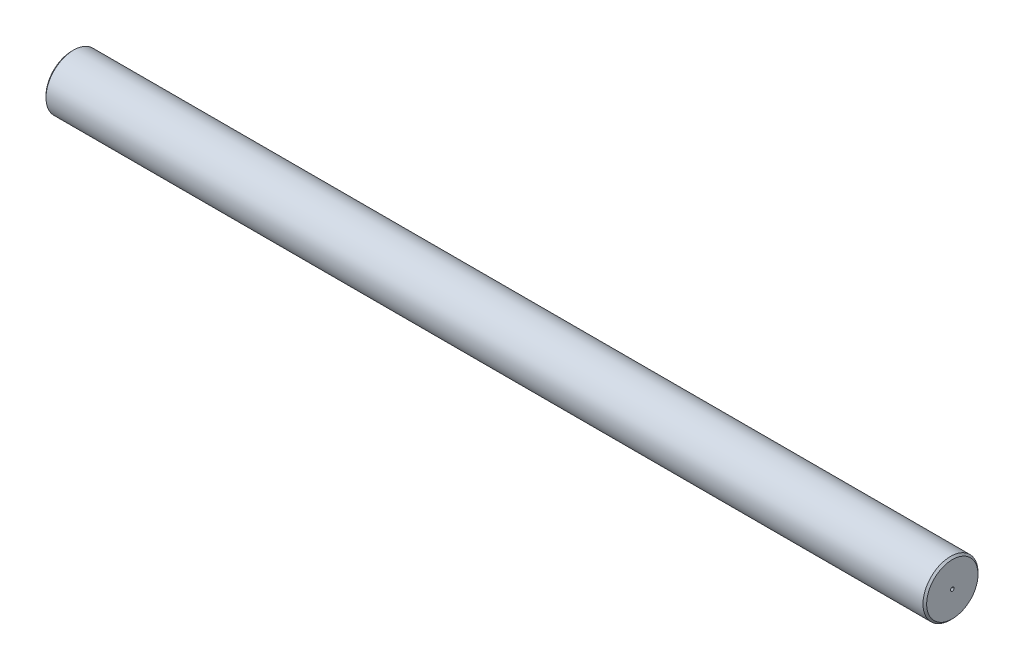
from build123d import *

# Parameters (mm, degrees)
SKETCH1_W     = 240
SKETCH1_H     = 7.5
CHAMFER1_SIZE = 0.5


with BuildPart() as part:
    # Sketch1 → Revolve1 (revolve)
    with BuildSketch(Plane.XY, mode=Mode.PRIVATE) as revolve1_sk:
        with Locations((120, 3.75)):
            Rectangle(SKETCH1_W, SKETCH1_H)
    revolve(revolve1_sk.sketch.rotate(Axis((0, 0, 0), (1, 0, 0)), 180), axis=Axis((0, 0, 0), (1, 0, 0)))

    # Sketch2 → Cut-Revolve1 (revolve, cut)
    with BuildSketch(Plane.XY, mode=Mode.PRIVATE) as cut_revolve1_sk:
        Polygon((0, 0.5), (0, 0), (0.5, 0), align=None)
        Polygon((239.5, 0), (240, 0.5), (240, 0), align=None)
    revolve(cut_revolve1_sk.sketch.rotate(Axis((0, 0, 0), (1, 0, 0)), 90), axis=Axis((0, 0, 0), (1, 0, 0)), mode=Mode.SUBTRACT)

    # Chamfer1
    chamfer1_edges = [part.edges().sort_by_distance(p)[0] for p in [
        (0, 7.5, 0),
        (240, 7.5, 0),
    ]]
    chamfer(chamfer1_edges, length=CHAMFER1_SIZE)


solid = part.part
